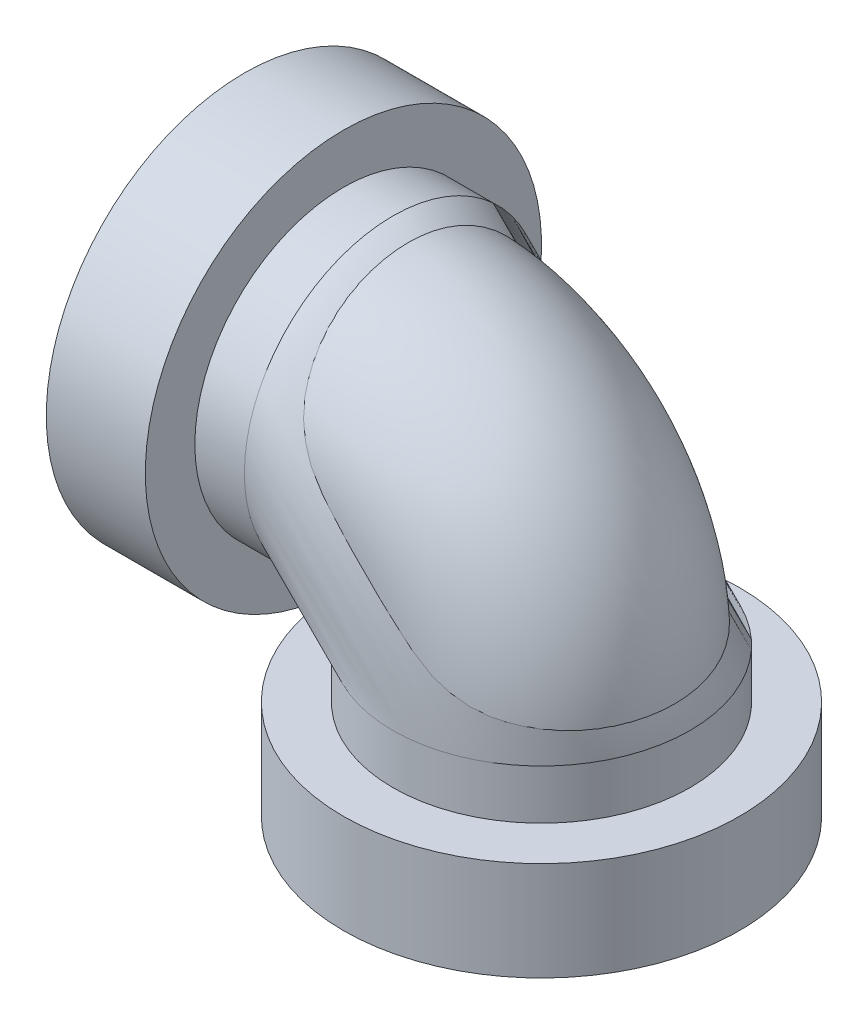
from build123d import *

# Parameters (mm, degrees)
SWEEP1_PROFILE_R     = 15
CUT_SWEEP1_PROFILE_R = 13.5
SKETCH11_R           = 20
SKETCH11_R_2         = 15
BOSS_EXTRUDE3_DEPTH  = 10
SKETCH27_R           = 20
SKETCH27_R_2         = 15
BOSS_EXTRUDE6_DEPTH  = 10


with BuildPart() as part:
    # Sweep1: sweep along a path in Sketch2
    with BuildLine(Plane.XY) as sweep1_path:
        Line((0, 0), (0, 15))
        ThreePointArc((0, 15), (-4.393398282, 25.606601718), (-15, 30))
        Line((-15, 30), (-30, 30))
    # Sweep1 profile (on start of the path) → Sweep1 (sweep)
    with BuildSketch(Plane(origin=(0, 0, 0), x_dir=(1, 0, 0), z_dir=(0, 1, 0))):
        Circle(SWEEP1_PROFILE_R)
    sweep(path=sweep1_path.line)

    # Cut-Sweep1: sweep along a path in Sketch2<2>
    with BuildLine(Plane.XY) as cut_sweep1_path:
        Line((0, 0), (0, 15))
        ThreePointArc((0, 15), (-4.393398282, 25.606601718), (-15, 30))
        Line((-15, 30), (-30, 30))
    # Cut-Sweep1 profile (on start of the path) → Cut-Sweep1 (sweep, cut)
    with BuildSketch(Plane(origin=(0, 0, 0), x_dir=(1, 0, 0), z_dir=(0, 1, 0))):
        Circle(CUT_SWEEP1_PROFILE_R)
    sweep(path=cut_sweep1_path.line, mode=Mode.SUBTRACT)


with BuildPart() as body_2:
    # Sketch11 → Boss-Extrude3 (new body)
    with BuildSketch(Plane(origin=(0, 0, 0), x_dir=(1, 0, 0), z_dir=(0, 1, 0))):
        Circle(SKETCH11_R)
        Circle(SKETCH11_R_2, mode=Mode.SUBTRACT)
    extrude(amount=BOSS_EXTRUDE3_DEPTH)


with BuildPart() as body_3:
    # Sketch27 → Boss-Extrude6 (new body)
    with BuildSketch(Plane.ZY.offset(30)):
        with Locations((0, 30)):
            Circle(SKETCH27_R)
        with Locations((0, 30)):
            Circle(SKETCH27_R_2, mode=Mode.SUBTRACT)
    extrude(amount=-BOSS_EXTRUDE6_DEPTH)


solid = Compound([part.part, body_2.part, body_3.part])
